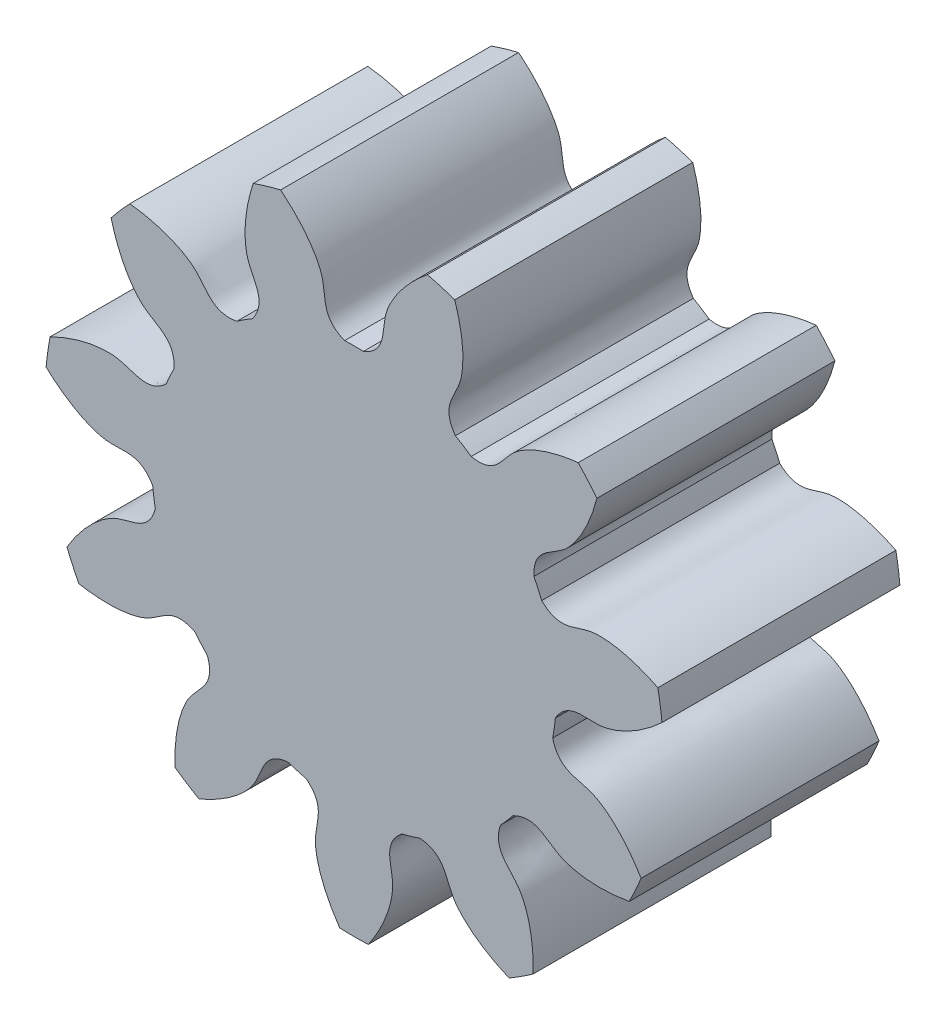
from build123d import *

# Parameters (mm, degrees)
SKETCH_1_R               = 6.500000002
EXTRUDE_1_DEPTH          = 5
CUT_EXTRUDE_1_DEPTH      = 11.464224771
PATTERN_CIRCULAR_1_COUNT = 11


with BuildPart() as part:
    # 草图1 → 凸台-拉伸1 (new body)
    with BuildSketch(Plane.XY):
        Circle(SKETCH_1_R)
    extrude(amount=EXTRUDE_1_DEPTH)

    # 草图2 → 切除-拉伸1 (cut, through all)
    with BuildSketch(Plane.XY):
        with BuildLine():
            ThreePointArc((0.196733046, 4.245444159), (0, 4.25), (-0.196733046, 4.245444159))
            add(Edge.make_bspline(
                [(-0.196733046, 4.245444159), (-0.701466589, 4.44659367), (-0.574607908, 4.858002432), (-0.682403134, 5.207536501), (-0.688559993, 5.226186945), (-0.695776188, 5.246660466), (-0.704125158, 5.268921732), (-0.713681519, 5.292932738), (-0.724518132, 5.318653362), (-0.736706925, 5.34604123), (-0.750318567, 5.375051792), (-0.765422491, 5.405638346), (-0.782086808, 5.437752064), (-0.800378263, 5.471342037), (-0.82036217, 5.506355302), (-0.842102366, 5.542736882), (-0.865661147, 5.580429826), (-0.891099222, 5.619375245), (-0.918475659, 5.659512359), (-0.94784783, 5.70077853), (-0.979271366, 5.743109317), (-1.012800104, 5.786438511), (-1.048486042, 5.830698188), (-1.086379287, 5.875818753), (-1.126528015, 5.921728989), (-1.168978424, 5.968356109), (-1.213774688, 6.015625803), (-1.260958921, 6.063462293), (-1.31057113, 6.111788385), (-1.362649179, 6.160525523), (-1.417228748, 6.209593846), (-1.4743433, 6.258912239), (-1.534024042, 6.308398397), (-1.596299894, 6.357968878), (-1.661197451, 6.407539163), (-1.728740959, 6.457023717), (-1.79895228, 6.506336046), (-1.871850865, 6.555388764), (-1.947453729, 6.604093649), (-2.025775421, 6.65236171), (-2.106828006, 6.700103249), (-2.190621041, 6.747227923), (-2.277161551, 6.793644814), (-2.366454014, 6.839262487), (-2.458500342, 6.883989061), (-2.553299866, 6.927732275), (-2.650849321, 6.970399551), (-2.751142832, 7.011898064), (-2.854171908, 7.05213481), (-2.959925425, 7.091016672), (-3.068389627, 7.128450487), (-3.179548115, 7.164343118), (-3.293381835, 7.198601521), (-3.450025719, 7.242347293), (-3.569469127, 7.271840708), (-3.650124806, 7.290081749)],
                knots=[0, 0, 0, 0, 0.219011067, 0.222641587, 0.226699227, 0.231183987, 0.236095867, 0.241434867, 0.247200988, 0.253394228, 0.260014588, 0.267062068, 0.274536668, 0.282438388, 0.290767228, 0.299523189, 0.308706269, 0.318316469, 0.328353789, 0.338818229, 0.34970979, 0.36102847, 0.37277427, 0.38494719, 0.39754723, 0.410574391, 0.424028671, 0.437910071, 0.452218591, 0.466954232, 0.482116992, 0.497706872, 0.513723872, 0.530167993, 0.547039233, 0.564337593, 0.582063073, 0.600215674, 0.618795394, 0.637802234, 0.657236195, 0.677097275, 0.697385475, 0.718100796, 0.739243236, 0.760812796, 0.782809477, 0.805233277, 0.828084197, 0.851362238, 0.875067398, 0.899199678, 0.923759079, 0.948745599, 1, 1, 1, 1], degree=3))
            ThreePointArc((-3.650124806, 7.290081749), (0, 8.152834048), (3.650124806, 7.290081749))
            add(Edge.make_bspline(
                [(0.196733046, 4.245444159), (0.701466589, 4.44659367), (0.574607908, 4.858002432), (0.682403134, 5.207536501), (0.688559993, 5.226186945), (0.695776188, 5.246660466), (0.704125158, 5.268921732), (0.713681519, 5.292932738), (0.724518132, 5.318653362), (0.736706925, 5.34604123), (0.750318567, 5.375051792), (0.765422491, 5.405638346), (0.782086808, 5.437752064), (0.800378263, 5.471342037), (0.82036217, 5.506355302), (0.842102366, 5.542736882), (0.865661147, 5.580429826), (0.891099222, 5.619375245), (0.918475659, 5.659512359), (0.94784783, 5.70077853), (0.979271366, 5.743109317), (1.012800104, 5.786438511), (1.048486042, 5.830698188), (1.086379287, 5.875818753), (1.126528015, 5.921728989), (1.168978424, 5.968356109), (1.213774688, 6.015625803), (1.260958921, 6.063462293), (1.31057113, 6.111788385), (1.362649179, 6.160525523), (1.417228748, 6.209593846), (1.4743433, 6.258912239), (1.534024042, 6.308398397), (1.596299894, 6.357968878), (1.661197451, 6.407539163), (1.728740959, 6.457023717), (1.79895228, 6.506336046), (1.871850865, 6.555388764), (1.947453729, 6.604093649), (2.025775421, 6.65236171), (2.106828006, 6.700103249), (2.190621041, 6.747227923), (2.277161551, 6.793644814), (2.366454014, 6.839262487), (2.458500342, 6.883989061), (2.553299866, 6.927732275), (2.650849321, 6.970399551), (2.751142832, 7.011898064), (2.854171908, 7.05213481), (2.959925425, 7.091016672), (3.068389627, 7.128450487), (3.179548115, 7.164343118), (3.293381835, 7.198601521), (3.450025719, 7.242347293), (3.569469127, 7.271840708), (3.650124806, 7.290081749)],
                knots=[0, 0, 0, 0, 0.219011067, 0.222641587, 0.226699227, 0.231183987, 0.236095867, 0.241434867, 0.247200988, 0.253394228, 0.260014588, 0.267062068, 0.274536668, 0.282438388, 0.290767228, 0.299523189, 0.308706269, 0.318316469, 0.328353789, 0.338818229, 0.34970979, 0.36102847, 0.37277427, 0.38494719, 0.39754723, 0.410574391, 0.424028671, 0.437910071, 0.452218591, 0.466954232, 0.482116992, 0.497706872, 0.513723872, 0.530167993, 0.547039233, 0.564337593, 0.582063073, 0.600215674, 0.618795394, 0.637802234, 0.657236195, 0.677097275, 0.697385475, 0.718100796, 0.739243236, 0.760812796, 0.782809477, 0.805233277, 0.828084197, 0.851362238, 0.875067398, 0.899199678, 0.923759079, 0.948745599, 1, 1, 1, 1], degree=3))
        make_face()
    cut_extrude_1 = extrude(amount=CUT_EXTRUDE_1_DEPTH, mode=Mode.SUBTRACT)

    # 阵列(圆周)1: 切除-拉伸1 ×11 about axis
    pattern_circular_1_axis = Axis((0, 0, -0.25), (0, 0, 1))
    for i in range(1, PATTERN_CIRCULAR_1_COUNT):
        add(cut_extrude_1.rotate(pattern_circular_1_axis, i * 360 / PATTERN_CIRCULAR_1_COUNT), mode=Mode.SUBTRACT)


solid = part.part
